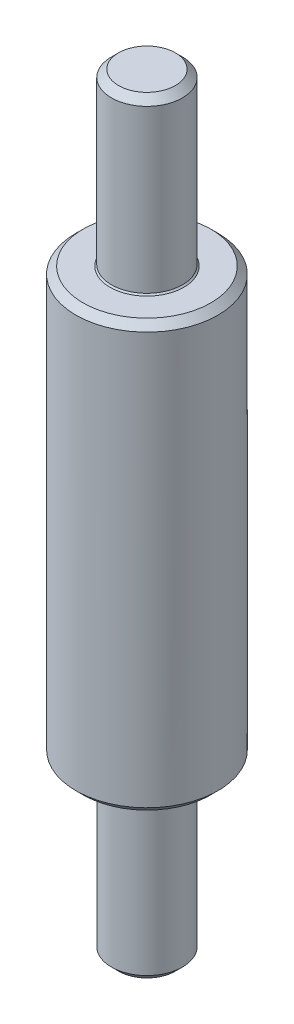
from build123d import *

# Parameters (mm, degrees)
CHAMFER_1_SIZE = 1
CHAMFER_2_SIZE = 0.2


with BuildPart() as part:
    # 草图1 → 旋转1 (revolve)
    with BuildSketch(Plane.XY, mode=Mode.PRIVATE) as revolve_1_sk:
        Polygon((0, 54), (5, 54), (5, 30), (10, 30), (10, -30), (5, -30), (5, -54), (0, -54), align=None)
    revolve(revolve_1_sk.sketch.rotate(Axis((0, 54, 0), (0, -1, 0)), 180), axis=Axis((0, 54, 0), (0, -1, 0)))

    # 倒角1
    chamfer_1_edges = [part.edges().sort_by_distance(p)[0] for p in [
        (5, -54, 0),
        (10, -30, 0),
        (10, 30, 0),
        (5, 54, 0),
    ]]
    chamfer(chamfer_1_edges, length=CHAMFER_1_SIZE)

    # 倒角2
    chamfer_2_edges = [part.edges().sort_by_distance(p)[0] for p in [
        (5, -30, 0),
        (5, 30, 0),
    ]]
    chamfer(chamfer_2_edges, length=CHAMFER_2_SIZE)


solid = part.part
